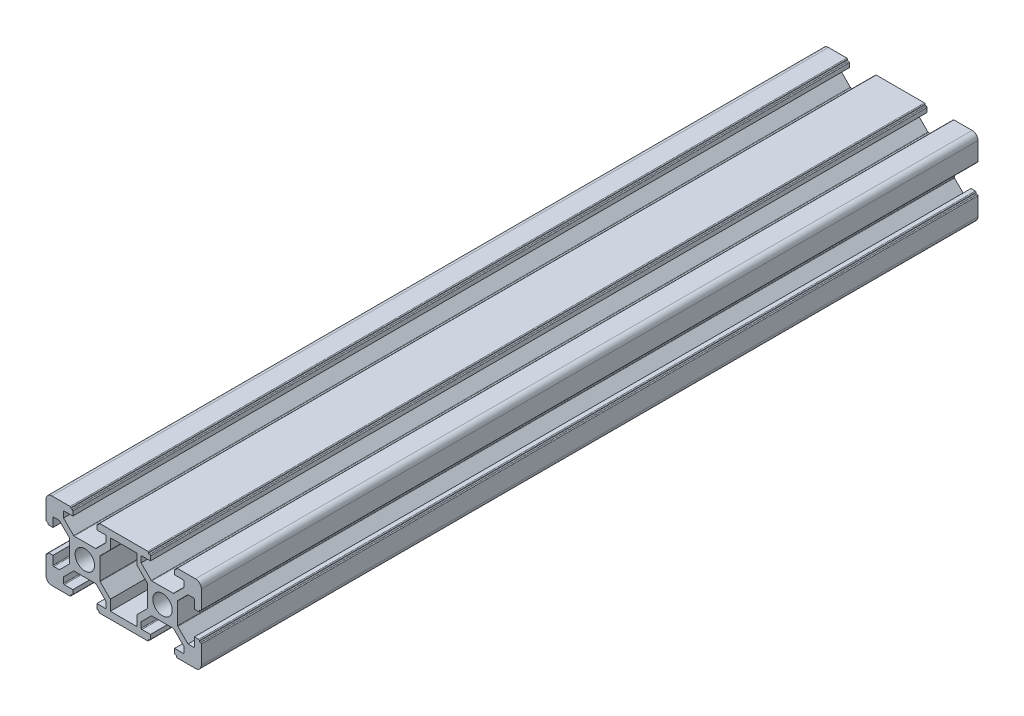
from build123d import *

# Parameters (mm, degrees)
BOSS_EXTRUDE1_DEPTH = 200
SKETCH2_R           = 2.5
CUT_EXTRUDE1_DEPTH  = 203.484567313
SKETCH3_R           = 1.5
CUT_EXTRUDE2_DEPTH  = 65


with BuildPart() as part:
    # Sketch1 → Boss-Extrude1 (new body)
    with BuildSketch(Plane.XY):
        with BuildLine():
            Line((-8.5, 10), (-3.8, 10))
            ThreePointArc((-3.8, 10), (-3.658578644, 9.941421356), (-3.6, 9.8))
            Line((-3.6, 9.8), (-3.6, 9.7))
            ThreePointArc((-3.6, 9.7), (-3.541421356, 9.558578644), (-3.4, 9.5))
            Line((-3.4, 9.5), (-3.3, 9.5))
            ThreePointArc((-3.3, 9.5), (-3.158578644, 9.441421356), (-3.1, 9.3))
            Line((-3.1, 9.3), (-3.1, 8.2))
            Line((-3.1, 8.2), (-5.3, 8.2))
            ThreePointArc((-5.3, 8.2), (-5.441421356, 8.141421356), (-5.5, 8))
            Line((-5.5, 8), (-5.5, 6.560660172))
            Line((-5.5, 6.560660172), (-2.897918472, 3.958578644))
            ThreePointArc((-2.897918472, 3.958578644), (-2.833033802, 3.915224093), (-2.756497116, 3.9))
            Line((-2.756497116, 3.9), (2.756497116, 3.9))
            ThreePointArc((2.756497116, 3.9), (2.833033802, 3.915224093), (2.897918472, 3.958578644))
            Line((2.897918472, 3.958578644), (5.5, 6.560660172))
            Line((5.5, 6.560660172), (5.5, 8))
            ThreePointArc((5.5, 8), (5.441421356, 8.141421356), (5.3, 8.2))
            Line((5.3, 8.2), (3.1, 8.2))
            Line((3.1, 8.2), (3.1, 9.3))
            ThreePointArc((3.1, 9.3), (3.158578644, 9.441421356), (3.3, 9.5))
            Line((3.3, 9.5), (3.4, 9.5))
            ThreePointArc((3.4, 9.5), (3.541421356, 9.558578644), (3.6, 9.7))
            Line((3.6, 9.7), (3.6, 9.8))
            ThreePointArc((3.6, 9.8), (3.658578644, 9.941421356), (3.8, 10))
            Line((3.8, 10), (8.5, 10))
            Line((8.5, 10), (11.5, 10))
            Line((11.5, 10), (16.2, 10))
            ThreePointArc((16.2, 10), (16.341421356, 9.941421356), (16.4, 9.8))
            Line((16.4, 9.8), (16.4, 9.7))
            ThreePointArc((16.4, 9.7), (16.458578644, 9.558578644), (16.6, 9.5))
            Line((16.6, 9.5), (16.7, 9.5))
            ThreePointArc((16.7, 9.5), (16.841421356, 9.441421356), (16.9, 9.3))
            Line((16.9, 9.3), (16.9, 8.2))
            Line((16.9, 8.2), (14.7, 8.2))
            ThreePointArc((14.7, 8.2), (14.558578644, 8.141421356), (14.5, 8))
            Line((14.5, 8), (14.5, 6.560660172))
            Line((14.5, 6.560660172), (17.102081528, 3.958578644))
            ThreePointArc((17.102081528, 3.958578644), (17.166966198, 3.915224093), (17.243502884, 3.9))
            Line((17.243502884, 3.9), (22.756497116, 3.9))
            ThreePointArc((22.756497116, 3.9), (22.833033802, 3.915224093), (22.897918472, 3.958578644))
            Line((22.897918472, 3.958578644), (25.5, 6.560660172))
            Line((25.5, 6.560660172), (25.5, 8))
            ThreePointArc((25.5, 8), (25.441421356, 8.141421356), (25.3, 8.2))
            Line((25.3, 8.2), (23.1, 8.2))
            Line((23.1, 8.2), (23.1, 9.3))
            ThreePointArc((23.1, 9.3), (23.158578644, 9.441421356), (23.3, 9.5))
            Line((23.3, 9.5), (23.4, 9.5))
            ThreePointArc((23.4, 9.5), (23.541421356, 9.558578644), (23.6, 9.7))
            Line((23.6, 9.7), (23.6, 9.8))
            ThreePointArc((23.6, 9.8), (23.658578644, 9.941421356), (23.8, 10))
            Line((23.8, 10), (28.5, 10))
            ThreePointArc((28.5, 10), (29.560660172, 9.560660172), (30, 8.5))
            Line((30, 8.5), (30, 3.8))
            ThreePointArc((30, 3.8), (29.941421356, 3.658578644), (29.8, 3.6))
            Line((29.8, 3.6), (29.7, 3.6))
            ThreePointArc((29.7, 3.6), (29.558578644, 3.541421356), (29.5, 3.4))
            Line((29.5, 3.4), (29.5, 3.3))
            ThreePointArc((29.5, 3.3), (29.441421356, 3.158578644), (29.3, 3.1))
            Line((29.3, 3.1), (28.2, 3.1))
            Line((28.2, 3.1), (28.2, 5.3))
            ThreePointArc((28.2, 5.3), (28.141421356, 5.441421356), (28, 5.5))
            Line((28, 5.5), (26.560660172, 5.5))
            Line((26.560660172, 5.5), (23.958578644, 2.897918472))
            ThreePointArc((23.958578644, 2.897918472), (23.915224093, 2.833033802), (23.9, 2.756497116))
            Line((23.9, 2.756497116), (23.9, -2.756497116))
            ThreePointArc((23.9, -2.756497116), (23.915224093, -2.833033802), (23.958578644, -2.897918472))
            Line((23.958578644, -2.897918472), (26.560660172, -5.5))
            Line((26.560660172, -5.5), (28, -5.5))
            ThreePointArc((28, -5.5), (28.141421356, -5.441421356), (28.2, -5.3))
            Line((28.2, -5.3), (28.2, -3.1))
            Line((28.2, -3.1), (29.3, -3.1))
            ThreePointArc((29.3, -3.1), (29.441421356, -3.158578644), (29.5, -3.3))
            Line((29.5, -3.3), (29.5, -3.4))
            ThreePointArc((29.5, -3.4), (29.558578644, -3.541421356), (29.7, -3.6))
            Line((29.7, -3.6), (29.8, -3.6))
            ThreePointArc((29.8, -3.6), (29.941421356, -3.658578644), (30, -3.8))
            Line((30, -3.8), (30, -8.5))
            ThreePointArc((30, -8.5), (29.560660172, -9.560660172), (28.5, -10))
            Line((28.5, -10), (23.8, -10))
            ThreePointArc((23.8, -10), (23.658578644, -9.941421356), (23.6, -9.8))
            Line((23.6, -9.8), (23.6, -9.7))
            ThreePointArc((23.6, -9.7), (23.541421356, -9.558578644), (23.4, -9.5))
            Line((23.4, -9.5), (23.3, -9.5))
            ThreePointArc((23.3, -9.5), (23.158578644, -9.441421356), (23.1, -9.3))
            Line((23.1, -9.3), (23.1, -8.2))
            Line((23.1, -8.2), (25.3, -8.2))
            ThreePointArc((25.3, -8.2), (25.441421356, -8.141421356), (25.5, -8))
            Line((25.5, -8), (25.5, -6.560660172))
            Line((25.5, -6.560660172), (22.897918472, -3.958578644))
            ThreePointArc((22.897918472, -3.958578644), (22.833033802, -3.915224093), (22.756497116, -3.9))
            Line((22.756497116, -3.9), (17.243502884, -3.9))
            ThreePointArc((17.243502884, -3.9), (17.166966198, -3.915224093), (17.102081528, -3.958578644))
            Line((17.102081528, -3.958578644), (14.5, -6.560660172))
            Line((14.5, -6.560660172), (14.5, -8))
            ThreePointArc((14.5, -8), (14.558578644, -8.141421356), (14.7, -8.2))
            Line((14.7, -8.2), (16.9, -8.2))
            Line((16.9, -8.2), (16.9, -9.3))
            ThreePointArc((16.9, -9.3), (16.841421356, -9.441421356), (16.7, -9.5))
            Line((16.7, -9.5), (16.6, -9.5))
            ThreePointArc((16.6, -9.5), (16.458578644, -9.558578644), (16.4, -9.7))
            Line((16.4, -9.7), (16.4, -9.8))
            ThreePointArc((16.4, -9.8), (16.341421356, -9.941421356), (16.2, -10))
            Line((16.2, -10), (11.5, -10))
            Line((11.5, -10), (8.5, -10))
            Line((8.5, -10), (3.8, -10))
            ThreePointArc((3.8, -10), (3.658578644, -9.941421356), (3.6, -9.8))
            Line((3.6, -9.8), (3.6, -9.7))
            ThreePointArc((3.6, -9.7), (3.541421356, -9.558578644), (3.4, -9.5))
            Line((3.4, -9.5), (3.3, -9.5))
            ThreePointArc((3.3, -9.5), (3.158578644, -9.441421356), (3.1, -9.3))
            Line((3.1, -9.3), (3.1, -8.2))
            Line((3.1, -8.2), (5.3, -8.2))
            ThreePointArc((5.3, -8.2), (5.441421356, -8.141421356), (5.5, -8))
            Line((5.5, -8), (5.5, -6.560660172))
            Line((5.5, -6.560660172), (2.897918472, -3.958578644))
            ThreePointArc((2.897918472, -3.958578644), (2.833033802, -3.915224093), (2.756497116, -3.9))
            Line((2.756497116, -3.9), (-2.756497116, -3.9))
            ThreePointArc((-2.756497116, -3.9), (-2.833033802, -3.915224093), (-2.897918472, -3.958578644))
            Line((-2.897918472, -3.958578644), (-5.5, -6.560660172))
            Line((-5.5, -6.560660172), (-5.5, -8))
            ThreePointArc((-5.5, -8), (-5.441421356, -8.141421356), (-5.3, -8.2))
            Line((-5.3, -8.2), (-3.1, -8.2))
            Line((-3.1, -8.2), (-3.1, -9.3))
            ThreePointArc((-3.1, -9.3), (-3.158578644, -9.441421356), (-3.3, -9.5))
            Line((-3.3, -9.5), (-3.4, -9.5))
            ThreePointArc((-3.4, -9.5), (-3.541421356, -9.558578644), (-3.6, -9.7))
            Line((-3.6, -9.7), (-3.6, -9.8))
            ThreePointArc((-3.6, -9.8), (-3.658578644, -9.941421356), (-3.8, -10))
            Line((-3.8, -10), (-8.5, -10))
            ThreePointArc((-8.5, -10), (-9.560660172, -9.560660172), (-10, -8.5))
            Line((-10, -8.5), (-10, -3.8))
            ThreePointArc((-10, -3.8), (-9.941421356, -3.658578644), (-9.8, -3.6))
            Line((-9.8, -3.6), (-9.7, -3.6))
            ThreePointArc((-9.7, -3.6), (-9.558578644, -3.541421356), (-9.5, -3.4))
            Line((-9.5, -3.4), (-9.5, -3.3))
            ThreePointArc((-9.5, -3.3), (-9.441421356, -3.158578644), (-9.3, -3.1))
            Line((-9.3, -3.1), (-8.2, -3.1))
            Line((-8.2, -3.1), (-8.2, -5.3))
            ThreePointArc((-8.2, -5.3), (-8.141421356, -5.441421356), (-8, -5.5))
            Line((-8, -5.5), (-6.560660172, -5.5))
            Line((-6.560660172, -5.5), (-3.958578644, -2.897918472))
            ThreePointArc((-3.958578644, -2.897918472), (-3.915224093, -2.833033802), (-3.9, -2.756497116))
            Line((-3.9, -2.756497116), (-3.9, 2.756497116))
            ThreePointArc((-3.9, 2.756497116), (-3.915224093, 2.833033802), (-3.958578644, 2.897918472))
            Line((-3.958578644, 2.897918472), (-6.560660172, 5.5))
            Line((-6.560660172, 5.5), (-8, 5.5))
            ThreePointArc((-8, 5.5), (-8.141421356, 5.441421356), (-8.2, 5.3))
            Line((-8.2, 5.3), (-8.2, 3.1))
            Line((-8.2, 3.1), (-9.3, 3.1))
            ThreePointArc((-9.3, 3.1), (-9.441421356, 3.158578644), (-9.5, 3.3))
            Line((-9.5, 3.3), (-9.5, 3.4))
            ThreePointArc((-9.5, 3.4), (-9.558578644, 3.541421356), (-9.7, 3.6))
            Line((-9.7, 3.6), (-9.8, 3.6))
            ThreePointArc((-9.8, 3.6), (-9.941421356, 3.658578644), (-10, 3.8))
            Line((-10, 3.8), (-10, 8.5))
            ThreePointArc((-10, 8.5), (-9.560660172, 9.560660172), (-8.5, 10))
        make_face()
        with BuildLine():
            Line((3.9, 2.756497116), (3.9, -2.756497116))
            ThreePointArc((3.9, -2.756497116), (3.915224093, -2.833033802), (3.958578644, -2.897918472))
            Line((3.958578644, -2.897918472), (6.560660172, -5.5))
            Line((6.560660172, -5.5), (6.560660172, -8.2))
            Line((6.560660172, -8.2), (13.439339828, -8.2))
            Line((13.439339828, -8.2), (13.439339828, -5.5))
            Line((13.439339828, -5.5), (16.041421356, -2.897918472))
            ThreePointArc((16.041421356, -2.897918472), (16.084775907, -2.833033802), (16.1, -2.756497116))
            Line((16.1, -2.756497116), (16.1, 2.756497116))
            ThreePointArc((16.1, 2.756497116), (16.084775907, 2.833033802), (16.041421356, 2.897918472))
            Line((16.041421356, 2.897918472), (13.439339828, 5.5))
            Line((13.439339828, 5.5), (13.439339828, 8.2))
            Line((13.439339828, 8.2), (6.560660172, 8.2))
            Line((6.560660172, 8.2), (6.560660172, 5.5))
            Line((6.560660172, 5.5), (3.958578644, 2.897918472))
            ThreePointArc((3.958578644, 2.897918472), (3.915224093, 2.833033802), (3.9, 2.756497116))
        make_face(mode=Mode.SUBTRACT)
    extrude(amount=BOSS_EXTRUDE1_DEPTH)

    # Sketch2 → Cut-Extrude1 (cut, through all)
    with BuildSketch(Plane.XY.offset(200)):
        Circle(SKETCH2_R)
        with Locations(Location((20, 0, 0), (0, 0, 180))):
            Circle(SKETCH2_R)
    extrude(amount=-CUT_EXTRUDE1_DEPTH, mode=Mode.SUBTRACT)

    # Sketch3 → Cut-Extrude2 (cut)
    with BuildSketch(Plane(origin=(23.9, 0, 0), x_dir=(0, 0, -1), z_dir=(1, 0, 0))):
        with Locations(Location((-183.3, 0, 0), (0, 0, 90))):
            Circle(SKETCH3_R)
        with Locations(Location((-166.6, 0, 0), (0, 0, 90))):
            Circle(SKETCH3_R)
    extrude(amount=-CUT_EXTRUDE2_DEPTH, mode=Mode.SUBTRACT)


solid = part.part
